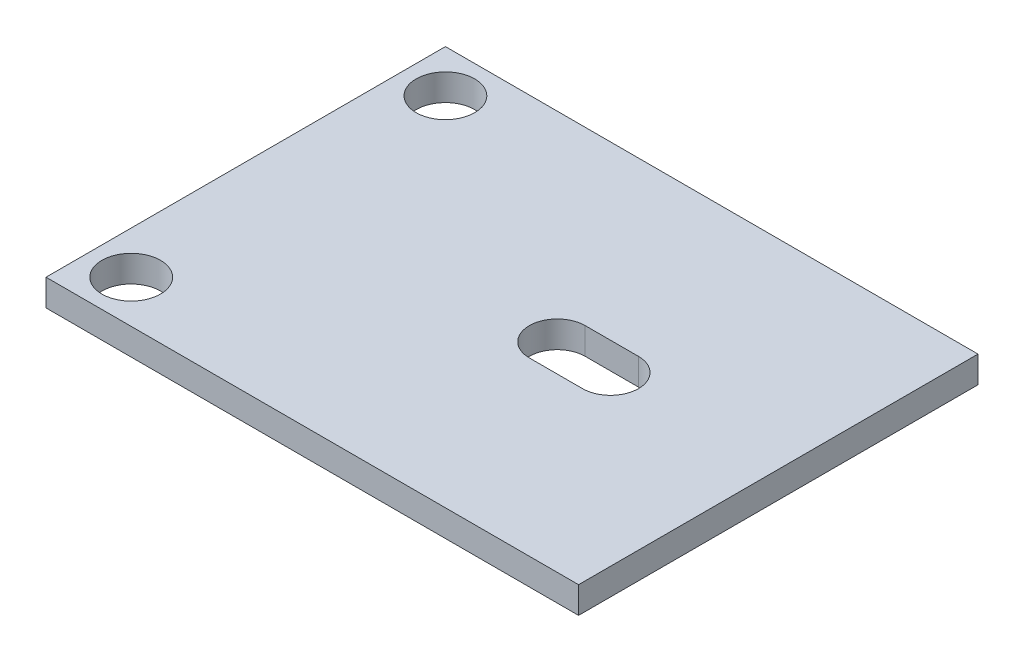
from build123d import *

# Parameters (mm, degrees)
ESQUISSE1_W             = 20
ESQUISSE1_H             = 15
BOSS_EXTRU_1_DEPTH      = 1
ESQUISSE2_R             = 1.1
ENL_V_MAT_EXTRU_1_DEPTH = 22.38340478


with BuildPart() as part:
    # Esquisse1 → Boss.-Extru.1 (new body)
    with BuildSketch(Plane(origin=(0, 0, 0), x_dir=(1, 0, 0), z_dir=(0, 1, 0))):
        with Locations((10, 0)):
            Rectangle(ESQUISSE1_W, ESQUISSE1_H)
    extrude(amount=BOSS_EXTRU_1_DEPTH)

    # Esquisse2 → Enlèv. mat.-Extru.1 (cut, through all)
    with BuildSketch(Plane(origin=(0, 1, 0), x_dir=(1, 0, 0), z_dir=(0, 1, 0))):
        with Locations(Location((1.6, 5.9, 0), (0, 0, 270))):
            Circle(ESQUISSE2_R)
        with Locations(Location((1.6, -5.9, 0), (0, 0, 270))):
            Circle(ESQUISSE2_R)
        with BuildLine():
            Line((11.7, 1.05), (13.7, 1.05))
            ThreePointArc((13.7, 1.05), (14.75, 0), (13.7, -1.05))
            Line((13.7, -1.05), (11.7, -1.05))
            ThreePointArc((11.7, -1.05), (10.65, 0), (11.7, 1.05))
        make_face()
    extrude(amount=-ENL_V_MAT_EXTRU_1_DEPTH, mode=Mode.SUBTRACT)


solid = part.part
